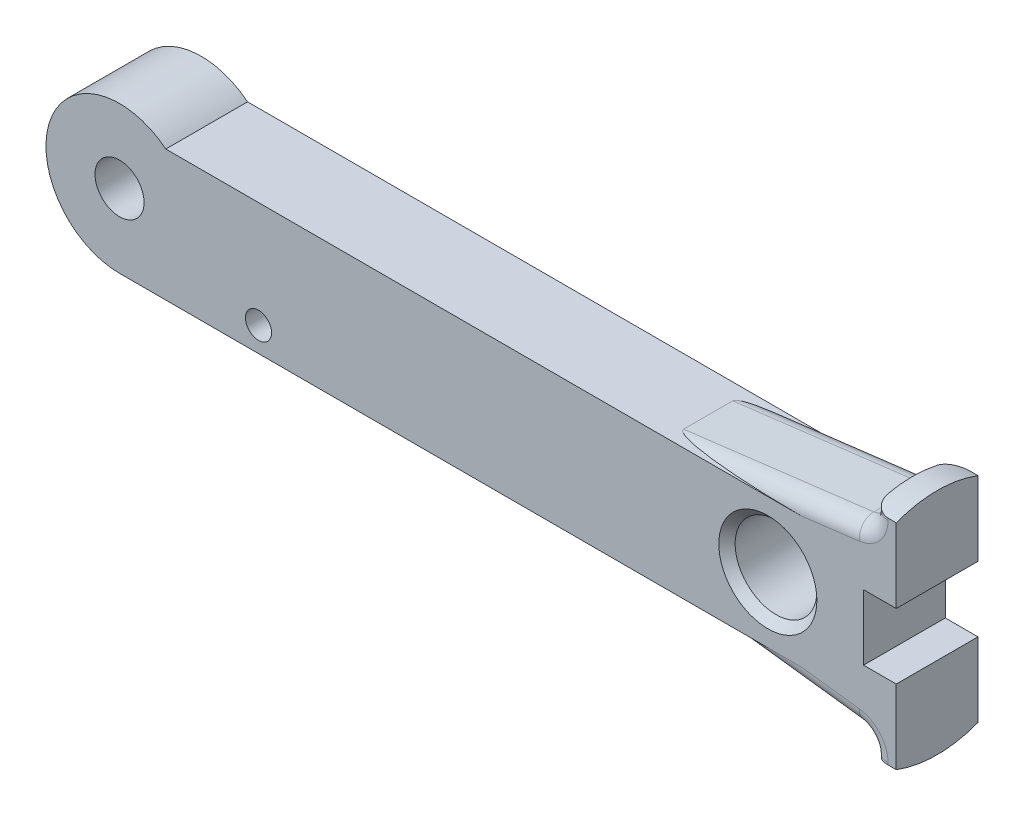
from build123d import *

# Parameters (mm, degrees)
SKETCH1_R                                       = 9
BOSS_EXTRUDE1_DEPTH                             = 10
SKETCH2_R                                       = 3
CUT_EXTRUDE1_DEPTH                              = 96.94790253
BOSS_EXTRUDE2_DEPTH                             = 3
SKETCH3_W                                       = 4
SKETCH3_H                                       = 8
CUT_EXTRUDE2_DEPTH                              = 97.695398029
RIB4_REACH                                      = 98.695
SKETCH5_WALL_W                                  = 220.579405852
SKETCH5_WALL_H                                  = 10
FILLET1_R                                       = 2
FILLET1_OF_MIRROR1_R                            = 2
SKETCH7_R                                       = 5
CUT_EXTRUDE3_DEPTH                              = 97.695398153
CHAMFER1_SIZE                                   = 1
CSK_FOR_M3_FLAT_HEAD_MACHINE_SCREW1_D           = 3.2
CSK_FOR_M3_FLAT_HEAD_MACHINE_SCREW1_CSINK_D     = 6.3
CSK_FOR_M3_FLAT_HEAD_MACHINE_SCREW1_CSINK_ANGLE = 90


with BuildPart() as part:
    # Sketch1 → Boss-Extrude1 (new body)
    with BuildSketch(Plane.XY):
        Circle(SKETCH1_R)
        with BuildLine():
            ThreePointArc((9, 0), (6.363961031, -6.363961031), (0, -9))
            Line((0, -9), (95, -9))
            Line((95, -9), (95, 7))
            Line((95, 7), (5.656854249, 7))
            ThreePointArc((5.656854249, 7), (8.121320344, 3.878679656), (9, 0))
        make_face()
    extrude(amount=BOSS_EXTRUDE1_DEPTH)

    # Sketch2 → Cut-Extrude1 (cut, through all)
    with BuildSketch(Plane.XY):
        Circle(SKETCH2_R)
    extrude(amount=CUT_EXTRUDE1_DEPTH, mode=Mode.SUBTRACT)

    # Sketch4 → Boss-Extrude2 (add)
    with BuildSketch(Plane(origin=(95, 0, 0), x_dir=(0, 0, -1), z_dir=(1, 0, 0))):
        with BuildLine():
            ThreePointArc((0, -14.076696831), (-5, -15), (-10, -14.076696831))
            Line((-10, -14.076696831), (-10, 12.076696831))
            ThreePointArc((-10, 12.076696831), (-5, 13), (0, 12.076696831))
            Line((0, 12.076696831), (0, -14.076696831))
        make_face()
    extrude(amount=-BOSS_EXTRUDE2_DEPTH)

    # Sketch3 → Cut-Extrude2 (cut, through all)
    with BuildSketch(Plane.XY):
        with Locations((93, -1)):
            Rectangle(SKETCH3_W, SKETCH3_H)
    extrude(amount=CUT_EXTRUDE2_DEPTH, mode=Mode.SUBTRACT)

    # Sketch5 wall → Rib4 (add, up to next)
    with BuildSketch(Plane(origin=(79.5, 8.538348415, 10), x_dir=(-0.992512099864, -0.122146353295, 0), z_dir=(0.122146353295, -0.992512099864, 0)), mode=Mode.PRIVATE) as rib4_sk1:
        with Locations((0, 5)):
            Rectangle(SKETCH5_WALL_W, SKETCH5_WALL_H)
    rib4_tool1 = extrude(rib4_sk1.sketch, amount=RIB4_REACH, mode=Mode.PRIVATE) - part.part
    rib4 = rib4_tool1.solids().sort_by_distance((79.5, 8.538348415, 10))[0]
    add(rib4)

    # Fillet1
    fillet1_edges = [part.edges().sort_by_distance(p)[0] for p in [
        (92, 11.076696831, 0),
        (92, 11.076696831, 10),
        (92, 10.07669683, 5),
        (79.500000002, 8.538348415, 0),
        (79.500000002, 8.538348415, 10),
    ]]
    fillet(fillet1_edges, radius=FILLET1_R)

    # Mirror1: Rib4 across plane
    add(rib4.mirror(Plane.ZX.offset(-1)))

    # Fillet1 of Mirror1
    fillet1_of_mirror1_edges = [part.edges().sort_by_distance(p)[0] for p in [
        (92, -13.076696831, 0),
        (92, -13.076696831, 10),
        (92, -12.07669683, 5),
        (79.500000002, -10.538348415, 0),
        (79.500000002, -10.538348415, 10),
    ]]
    fillet(fillet1_of_mirror1_edges, radius=FILLET1_OF_MIRROR1_R)

    # Sketch7 → Cut-Extrude3 (cut, through all)
    with BuildSketch(Plane.XY):
        with Locations((79.294775575, -1)):
            Circle(SKETCH7_R)
    extrude(amount=CUT_EXTRUDE3_DEPTH, mode=Mode.SUBTRACT)

    # Chamfer1
    chamfer1_edges = [part.edges().sort_by_distance(p)[0] for p in [
        (74.294775575, -1, 0),
        (74.294775575, -1, 10),
    ]]
    chamfer(chamfer1_edges, length=CHAMFER1_SIZE)

    # CSK for M3 Flat Head Machine Screw1 (through all)
    with Locations(Plane(origin=(0, 0, 0), x_dir=(-1, 0, 0), z_dir=(0, 0, -1))):
        with Locations((-17, -6)):
            CounterSinkHole(CSK_FOR_M3_FLAT_HEAD_MACHINE_SCREW1_D / 2, CSK_FOR_M3_FLAT_HEAD_MACHINE_SCREW1_CSINK_D / 2, counter_sink_angle=CSK_FOR_M3_FLAT_HEAD_MACHINE_SCREW1_CSINK_ANGLE)


solid = part.part
